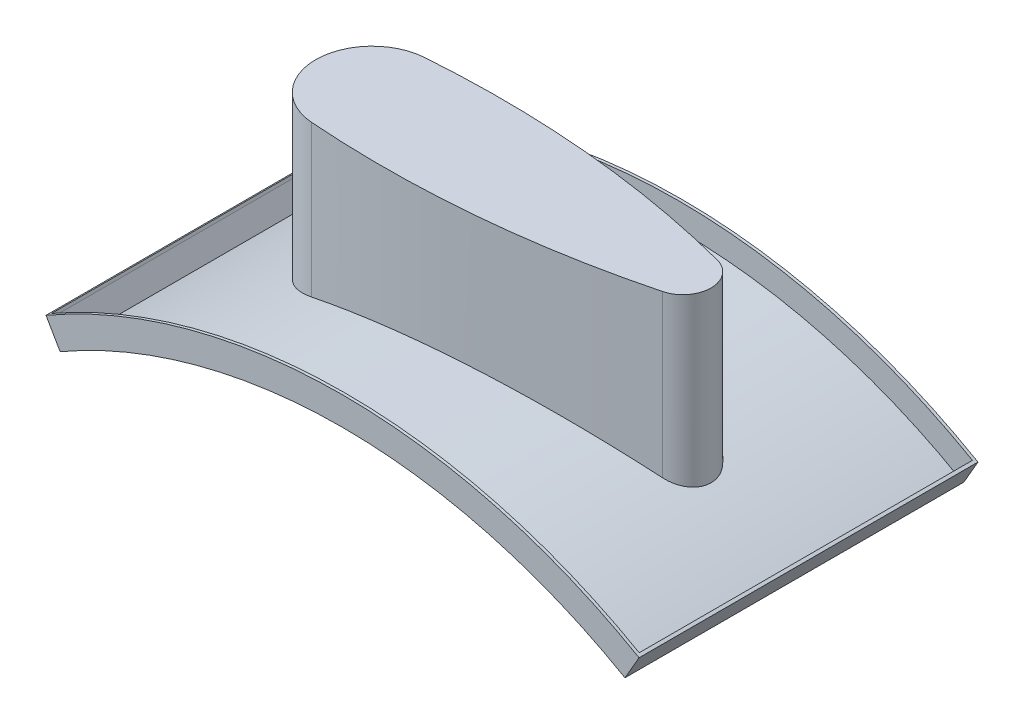
from build123d import *

# Parameters (mm, degrees)
BOSS_EXTRUDE1_DEPTH = 120
CUT_EXTRUDE1_DEPTH  = 118
BOSS_EXTRUDE2_DEPTH = 248
CUT_EXTRUDE2_DEPTH  = 269


with BuildPart() as part:
    # Sketch1 → Boss-Extrude1 (new body)
    with BuildSketch(Plane.XY):
        with BuildLine():
            Line((-105, 181.865334795), (-100, 173.205080757))
            ThreePointArc((-100, 173.205080757), (0, 200), (100, 173.205080757))
            Line((100, 173.205080757), (105, 181.865334795))
            ThreePointArc((105, 181.865334795), (0, 210), (-105, 181.865334795))
        make_face()
    extrude(amount=BOSS_EXTRUDE1_DEPTH)

    # Sketch2 → Cut-Extrude1 (cut)
    with BuildSketch(Plane.XY.offset(119)):
        with BuildLine():
            ThreePointArc((99.632730807, 174.568951855), (0, 201), (-99.632730807, 174.568951855))
            Line((-99.632730807, 174.568951855), (-103.632778417, 181.497237548))
            Line((-103.632778417, 181.497237548), (-105, 184.581371686))
            Line((-105, 184.581371686), (38.612235753, 274.588582832))
            Line((38.612235753, 274.588582832), (105, 184.581371686))
            Line((105, 184.581371686), (103.632778417, 181.497237548))
            Line((103.632778417, 181.497237548), (99.632730807, 174.568951855))
        make_face()
    extrude(amount=-CUT_EXTRUDE1_DEPTH, mode=Mode.SUBTRACT)

    # Sketch3 → Boss-Extrude2 (add)
    with BuildSketch(Plane(origin=(0, 0, 0), x_dir=(1, 0, 0), z_dir=(0, 1, 0))):
        with BuildLine():
            ThreePointArc((-51.003018744, -40.055400821), (-69.515415438, -60), (-51.003018744, -79.944599179))
            ThreePointArc((-51.003018744, -79.944599179), (6.419962074, -79.503661207), (62.997953546, -69.67899666))
            ThreePointArc((62.997953546, -69.67899666), (70.484584562, -60), (62.997953546, -50.32100334))
            ThreePointArc((62.997953546, -50.32100334), (6.419962074, -40.496338793), (-51.003018744, -40.055400821))
        make_face()
    extrude(amount=BOSS_EXTRUDE2_DEPTH)

    # Sketch4 → Cut-Extrude2 (cut)
    with BuildSketch(Plane.XY):
        with BuildLine():
            Line((70.484584562, 187.168168606), (163.146781593, -79.750206807))
            Line((163.146781593, -79.750206807), (-229.131099013, -106.991726293))
            Line((-229.131099013, -106.991726293), (-69.515415438, 187.530282932))
            ThreePointArc((-69.515415438, 187.530282932), (0.51730445, 199.999330989), (70.484584562, 187.168168606))
        make_face()
    extrude(amount=CUT_EXTRUDE2_DEPTH, mode=Mode.SUBTRACT)


solid = part.part
